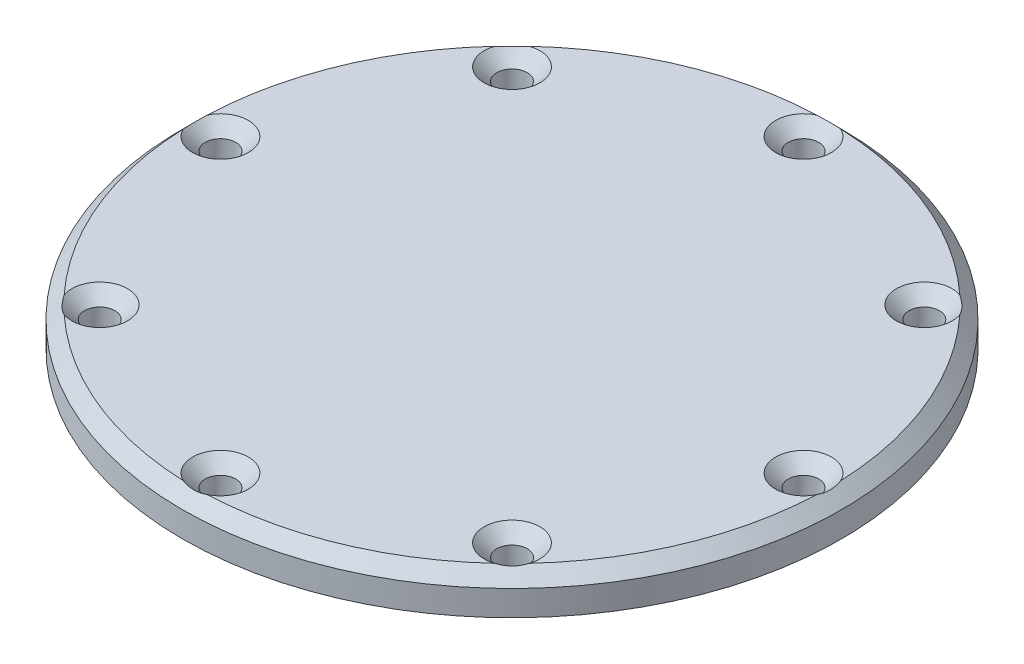
from build123d import *

# Parameters (mm, degrees)
HOLE_WIZARD_M21_D           = 2.4
HOLE_WIZARD_M21_CSINK_D     = 4.4
HOLE_WIZARD_M21_CSINK_ANGLE = 90
PATTERN_CIRCULAR_1_COUNT    = 8


with BuildPart() as part:
    # Эскиз1 → Повернуть1 (revolve)
    with BuildSketch(Plane.XY, mode=Mode.PRIVATE) as revolve_1_sk:
        Polygon((0, 0), (26, 0), (26, 2), (25, 3), (0, 3), align=None)
    revolve(revolve_1_sk.sketch.rotate(Axis((0, 0, 0), (0, 1, 0)), 90), axis=Axis((0, 0, 0), (0, 1, 0)))

    # Зенковка для винта с потайной головкой M21 (through all)
    with Locations(Plane(origin=(0, 3, 0), x_dir=(1, 0, 0), z_dir=(0, 1, 0))):
        with Locations((16.263455967, 16.263455967)):
            hole_wizard_m21 = CounterSinkHole(HOLE_WIZARD_M21_D / 2, HOLE_WIZARD_M21_CSINK_D / 2, counter_sink_angle=HOLE_WIZARD_M21_CSINK_ANGLE)

    # Круговой массив1: Зенковка для винта с потайной головкой M21 ×8 about axis
    pattern_circular_1_axis = Axis((0, 0, 0), (0, 1, 0))
    for i in range(1, PATTERN_CIRCULAR_1_COUNT):
        add(hole_wizard_m21.rotate(pattern_circular_1_axis, i * 360 / PATTERN_CIRCULAR_1_COUNT), mode=Mode.SUBTRACT)


solid = part.part
